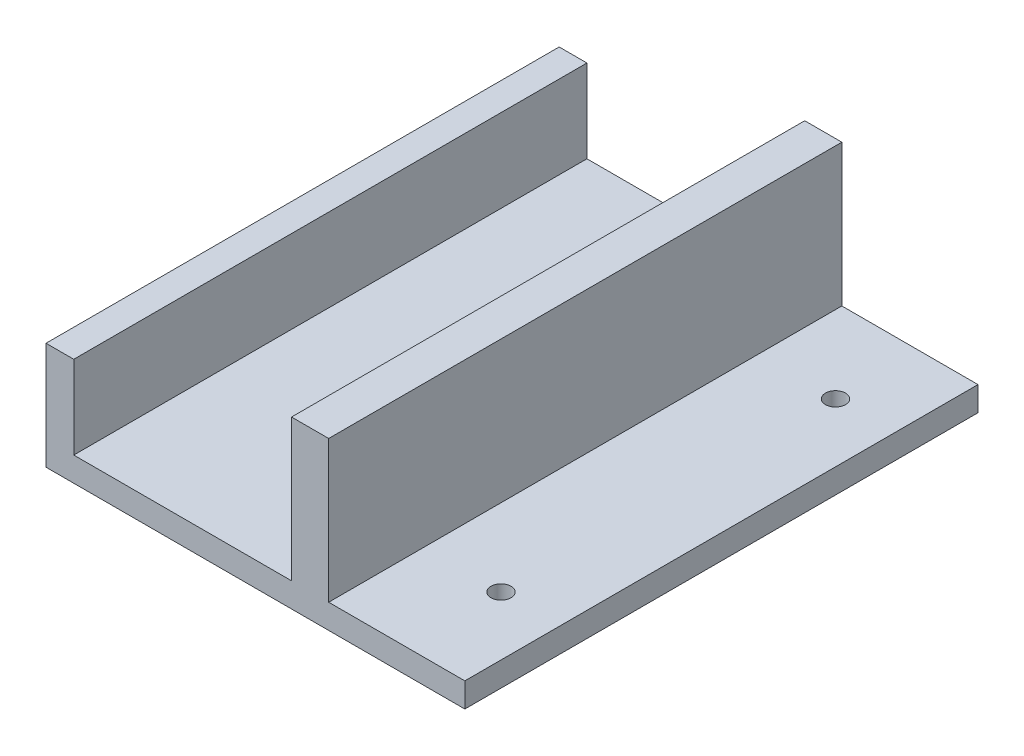
from build123d import *

# Parameters (mm, degrees)
SKETCH1_W           = 8.3
SKETCH1_H           = 24.8
SKETCH1_W_2         = 125.2
SKETCH1_H_2         = 7.3
SKETCH1_W_3         = 11.1
SKETCH1_H_3         = 42.4
BOSS_EXTRUDE1_DEPTH = 153.4
SKETCH2_R           = 3
CUT_EXTRUDE1_DEPTH  = 153.4
LPATTERN1_COUNT     = 2
LPATTERN1_PITCH     = 100


with BuildPart() as part:
    # Sketch1 → Boss-Extrude1 (new body)
    with BuildSketch(Plane.XY):
        with Locations((-58.45, 16.05)):
            Rectangle(SKETCH1_W, SKETCH1_H)
        Rectangle(SKETCH1_W_2, SKETCH1_H_2)
        with Locations((16.35, 24.85)):
            Rectangle(SKETCH1_W_3, SKETCH1_H_3)
    extrude(amount=BOSS_EXTRUDE1_DEPTH)

    # Sketch2 → Cut-Extrude1 (cut)
    with BuildSketch(Plane(origin=(0, 3.65, 0), x_dir=(1, 0, 0), z_dir=(0, 1, 0))):
        with Locations(Location((45, -25, 0), (0, 0, 270))):
            Circle(SKETCH2_R)
    cut_extrude1 = extrude(amount=-CUT_EXTRUDE1_DEPTH, mode=Mode.SUBTRACT)

    # LPattern1: Cut-Extrude1 ×2
    with Locations(*[(0, 0, i * LPATTERN1_PITCH) for i in range(1, LPATTERN1_COUNT)]):
        add(cut_extrude1, mode=Mode.SUBTRACT)


solid = part.part
